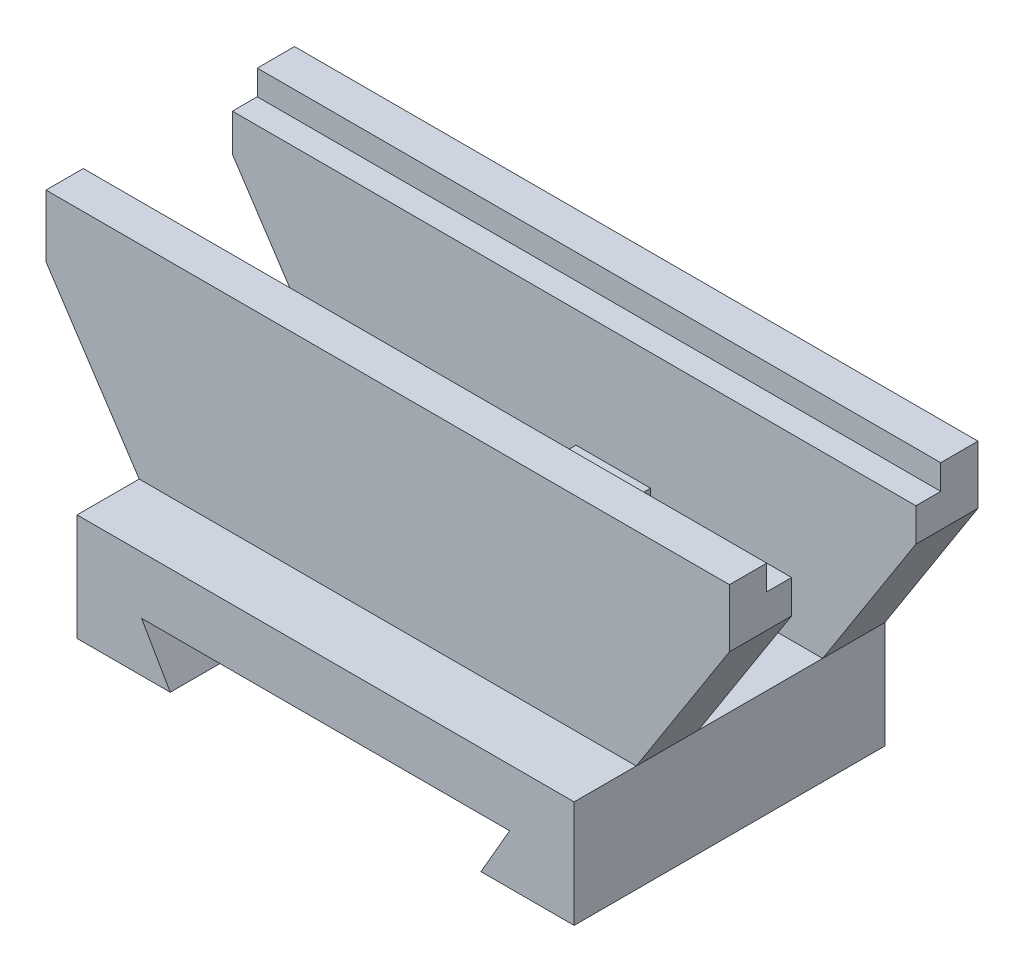
from build123d import *

# Parameters (mm, degrees)
BOSS_EXTRUDE1_DEPTH     = 50
BOSS_EXTRUDE2_DEPTH     = 10
BOSS_EXTRUDE3_START     = 30
BOSS_EXTRUDE3_DEPTH     = 10
SKETCH3_W               = 12
SKETCH3_H               = 10
BOSS_EXTRUDE4_DEPTH     = 15
CUT_EXTRUDE1_DEPTH      = 119.427192823
CUT_EXTRUDE1_DEPTH_BACK = 119.427192823
SKETCH4_R               = 3
SKETCH4_W               = 28
SKETCH4_H               = 4


with BuildPart() as part:
    # Sketch1 → Boss-Extrude1 (new body)
    with BuildSketch(Plane.XY):
        Polygon((69.618802154, 8), (65, 0), (80, 0), (80, 17.220839506), (0, 17.220839506), (0, 0), (15, 0), (10.381197846, 8), align=None)
    extrude(amount=BOSS_EXTRUDE1_DEPTH)

    # Sketch2 → Boss-Extrude2 (add)
    with BuildSketch(Plane.XY):
        Polygon((0, 17.220839506), (80, 17.220839506), (95, 40.639434385), (95, 50), (-15, 50), (-15, 39.999070977), align=None)
    extrude(amount=BOSS_EXTRUDE2_DEPTH)

    # Sketch2<3> → Boss-Extrude3 (add)
    with BuildSketch(Plane.XY.offset(BOSS_EXTRUDE3_START)):
        Polygon((0, 17.220839506), (80, 17.220839506), (95, 40.639434385), (95, 50), (-15, 50), (-15, 39.999070977), align=None)
    extrude(amount=BOSS_EXTRUDE3_DEPTH)

    # Sketch3 → Boss-Extrude4 (add)
    with BuildSketch(Plane(origin=(0, 17.220839506, 0), x_dir=(1, 0, 0), z_dir=(0, 1, 0))):
        with Locations((51.419853225, -20.126174842)):
            Rectangle(SKETCH3_W, SKETCH3_H)
    extrude(amount=BOSS_EXTRUDE4_DEPTH)

    # Sketch4 → Cut-Extrude1 (cut, two sides: drawn at the far end of the back side and taken through both)
    with BuildSketch(Plane(origin=(0, 0, 0), x_dir=(0, 0, -1), z_dir=(1, 0, 0)).offset(-CUT_EXTRUDE1_DEPTH_BACK)):
        with Locations((-20.126174842, 25.220839506)):
            Circle(SKETCH4_R)
        with Locations((-20, 48)):
            Rectangle(SKETCH4_W, SKETCH4_H)
    extrude(amount=CUT_EXTRUDE1_DEPTH + CUT_EXTRUDE1_DEPTH_BACK, mode=Mode.SUBTRACT)


solid = part.part
